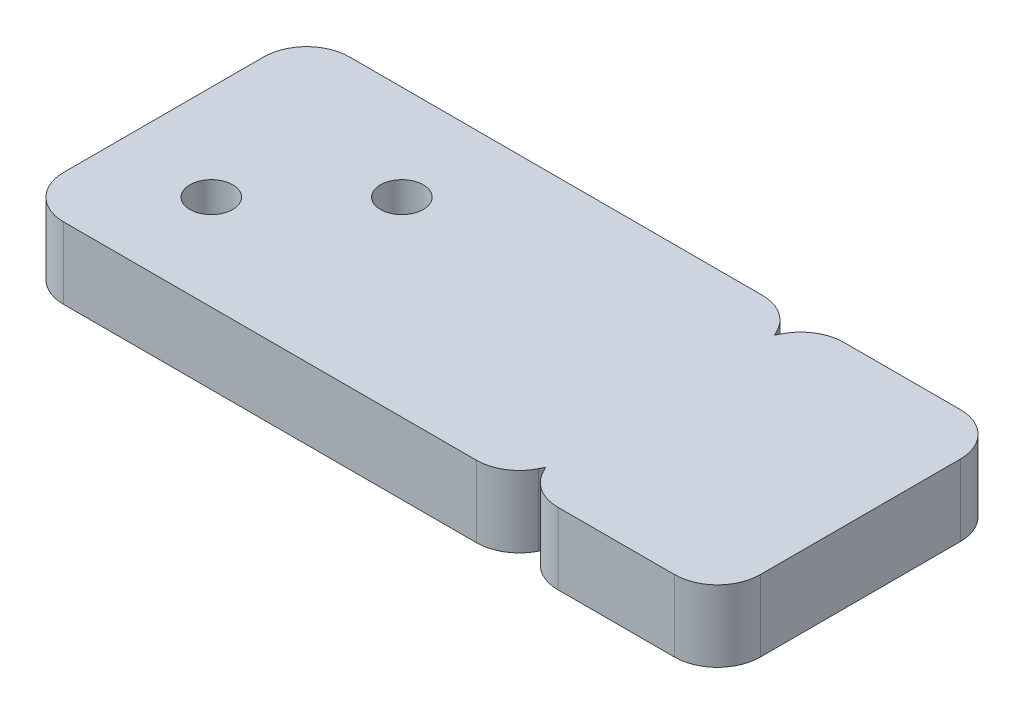
from build123d import *

# Parameters (mm, degrees)
SKETCH1_R           = 1.905
BOSS_EXTRUDE3_DEPTH = 6.35
FILLET4_R           = 3.81


with BuildPart() as part:
    # Sketch1 → Boss-Extrude3 (new body)
    with BuildSketch(Plane(origin=(0, 0, 0), x_dir=(1, 0, 0), z_dir=(0, 1, 0))):
        Polygon((-65.88775931, 11.594773286), (-65.88775931, -13.805226714), (-23.03795931, -13.805226714), (-21.76795931, -11.265226714), (-20.49795931, -13.805226714), (-3.97525931, -13.805226714), (-3.97525931, 11.594773286), (-20.49795931, 11.594773286), (-21.76795931, 9.054773286), (-23.03795931, 11.594773286), align=None)
        with Locations(Location((-57.421862263, -5.339329667, 0), (0, 0, 270))):
            Circle(SKETCH1_R, mode=Mode.SUBTRACT)
        with Locations(Location((-48.953147413, 3.129385183, 0), (0, 0, 270))):
            Circle(SKETCH1_R, mode=Mode.SUBTRACT)
    extrude(amount=BOSS_EXTRUDE3_DEPTH)

    # Fillet4
    fillet4_edges = [part.edges().sort_by_distance(p)[0] for p in [
        (-23.03795931, 3.175, -11.594773286),
        (-20.49795931, 3.175, -11.594773286),
        (-3.97525931, 3.175, -11.594773286),
        (-3.97525931, 3.175, 13.805226714),
        (-20.49795931, 3.175, 13.805226714),
        (-23.03795931, 3.175, 13.805226714),
        (-65.88775931, 3.175, 13.805226714),
        (-65.88775931, 3.175, -11.594773286),
    ]]
    fillet(fillet4_edges, radius=FILLET4_R)


solid = part.part
